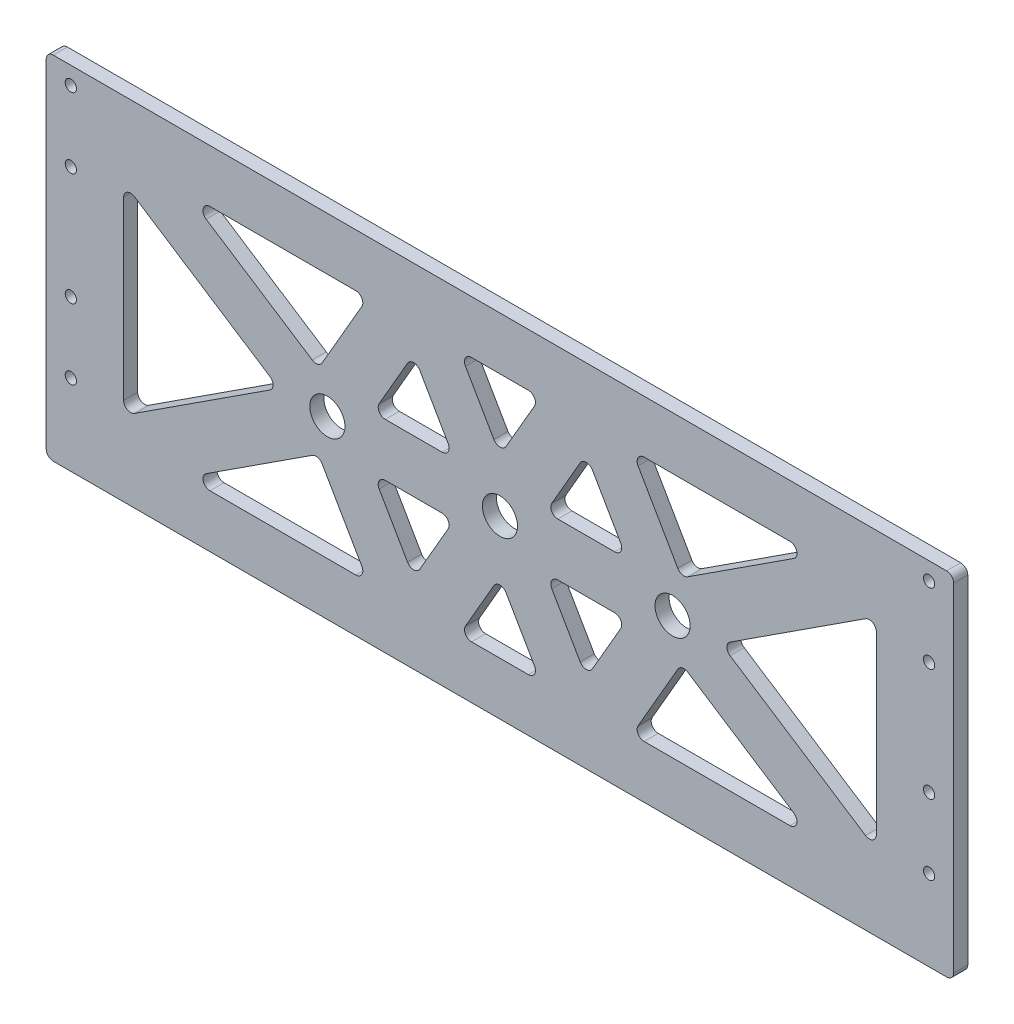
from build123d import *

# Parameters (mm, degrees)
SKETCH_1_W          = 258
SKETCH_1_H          = 100
EXTRUDE_1_DEPTH     = 4
FILLET_1_R          = 2
SKETCH_2_R          = 1.6
CUT_EXTRUDE_1_DEPTH = 139.408814748
SKETCH_3_R          = 5
CUT_EXTRUDE_2_DEPTH = 139.408814748
FILLET_2_R          = 2
SKETCH_4_R          = 5
CUT_EXTRUDE_3_DEPTH = 139.408814748


with BuildPart() as part:
    # 草图1 → 凸台-拉伸1 (new body)
    with BuildSketch(Plane.XY):
        Rectangle(SKETCH_1_W, SKETCH_1_H)
    extrude(amount=EXTRUDE_1_DEPTH)

    # 圆角1
    fillet_1_edges = [part.edges().sort_by_distance(p)[0] for p in [
        (129, -50, 2),
        (-129, -50, 2),
        (-129, 50, 2),
        (129, 50, 2),
    ]]
    fillet(fillet_1_edges, radius=FILLET_1_R)

    # 草图2 → 切除-拉伸1 (cut, through all)
    with BuildSketch(Plane(origin=(0, 0, 0), x_dir=(-1, 0, 0), z_dir=(0, 0, -1))):
        with Locations((-122, -27)):
            Circle(SKETCH_2_R)
        with Locations((-122, -7)):
            Circle(SKETCH_2_R)
        with Locations((-122, 25)):
            Circle(SKETCH_2_R)
        with Locations((-122, 45)):
            Circle(SKETCH_2_R)
        with Locations((122, -27)):
            Circle(SKETCH_2_R)
        with Locations((122, -7)):
            Circle(SKETCH_2_R)
        with Locations((122, 25)):
            Circle(SKETCH_2_R)
        with Locations((122, 45)):
            Circle(SKETCH_2_R)
    extrude(amount=-CUT_EXTRUDE_1_DEPTH, mode=Mode.SUBTRACT)

    # 草图3 → 切除-拉伸2 (cut, through all)
    with BuildSketch(Plane.XY.offset(4)):
        Polygon((-107, 28.684529573), (-107, -28.684529573), (-62.842544422, 0), align=None)
        Polygon((-24.537386441, 27.5), (-36.084391824, 7.5), (-12.990381057, 7.5), align=None)
        Polygon((-37.527767497, 35), (-89.186600144, 35), (-51.617762103, 10.595413465), align=None)
        Polygon((-51.617762103, -10.595413465), (-89.186600144, -35), (-37.527767497, -35), align=None)
        Polygon((-12.990381057, -7.5), (-36.084391824, -7.5), (-24.537386441, -27.5), align=None)
        Polygon((0, -15), (-11.547005384, -35), (11.547005384, -35), align=None)
        Polygon((-11.547005384, 35), (0, 15), (11.547005384, 35), align=None)
        Polygon((36.084391824, -7.5), (12.990381057, -7.5), (24.537386441, -27.5), align=None)
        Polygon((89.186600144, 35), (37.527767497, 35), (51.617762103, 10.595413465), align=None)
        Polygon((107, 28.684529573), (62.842544422, 0), (107, -28.684529573), align=None)
        Polygon((89.186600144, -35), (51.617762103, -10.595413465), (37.527767497, -35), align=None)
        Polygon((24.537386441, 27.5), (12.990381057, 7.5), (36.084391824, 7.5), align=None)
        with Locations((-49.074772881, 0)):
            Circle(SKETCH_3_R)
        with Locations((49.074772881, 0)):
            Circle(SKETCH_3_R)
    extrude(amount=-CUT_EXTRUDE_2_DEPTH, mode=Mode.SUBTRACT)

    # 圆角2
    fillet_2_edges = [part.edges().sort_by_distance(p)[0] for p in [
        (-24.537386441, 27.5, 2),
        (-12.990381057, 7.5, 2),
        (-36.084391824, 7.5, 2),
        (-37.527767497, 35, 2),
        (-51.617762103, 10.595413465, 2),
        (-89.186600144, 35, 2),
        (-89.186600144, -35, 2),
        (-51.617762103, -10.595413465, 2),
        (-37.527767497, -35, 2),
        (-12.990381057, -7.5, 2),
        (-24.537386441, -27.5, 2),
        (-36.084391824, -7.5, 2),
        (-11.547005384, -35, 2),
        (0, -15, 2),
        (11.547005384, -35, 2),
        (11.547005384, 35, 2),
        (0, 15, 2),
        (-11.547005384, 35, 2),
        (24.537386441, -27.5, 2),
        (12.990381057, -7.5, 2),
        (36.084391824, -7.5, 2),
        (37.527767497, 35, 2),
        (89.186600144, 35, 2),
        (51.617762103, 10.595413465, 2),
        (36.084391824, 7.5, 2),
        (12.990381057, 7.5, 2),
        (24.537386441, 27.5, 2),
        (107, -28.684529573, 2),
        (62.842544422, 0, 2),
        (107, 28.684529573, 2),
        (37.527767497, -35, 2),
        (51.617762103, -10.595413465, 2),
        (89.186600144, -35, 2),
        (-62.842544422, 0, 2),
        (-107, -28.684529573, 2),
        (-107, 28.684529573, 2),
    ]]
    fillet(fillet_2_edges, radius=FILLET_2_R)

    # 草图4 → 切除-拉伸3 (cut, through all)
    with BuildSketch(Plane.XY.offset(4)):
        Circle(SKETCH_4_R)
    extrude(amount=-CUT_EXTRUDE_3_DEPTH, mode=Mode.SUBTRACT)


solid = part.part
